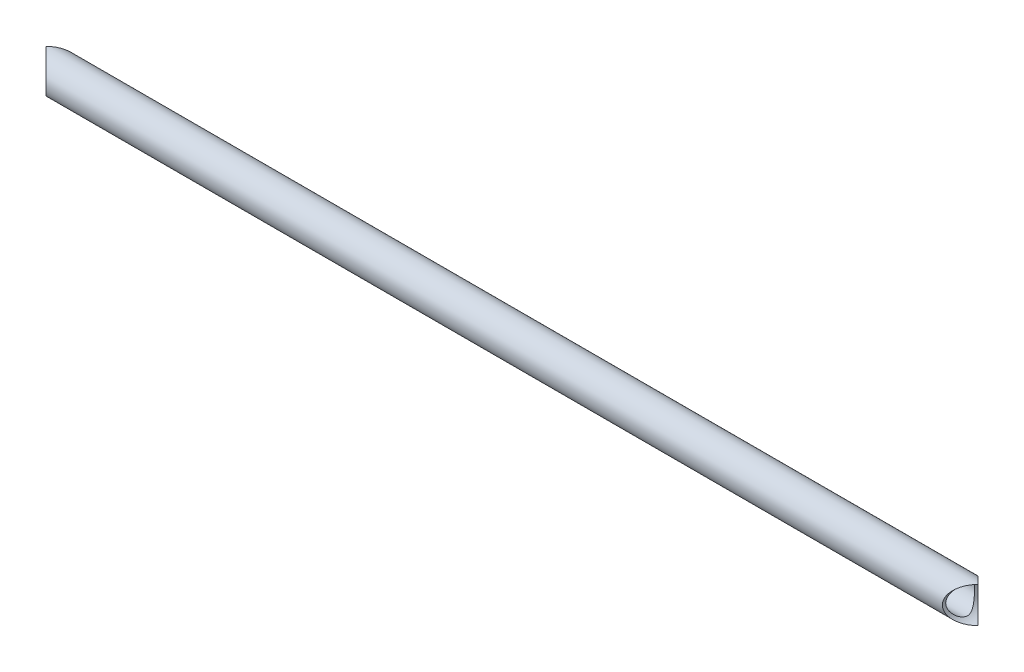
from build123d import *

# Parameters (mm, degrees)
SKETCH1_R                          = 7.9375
SKETCH1_R_2                        = 6.4375
PIPE_CONFIGURED_21_3_X_2_3_3_DEPTH = 415.043480752
CORTE_EXTRUS_O1_DEPTH              = 562.915780451
CORTE_EXTRUS_O1_DEPTH_BACK         = 562.915780451
ESBO_O10_R                         = 7.9375
CORTE_EXTRUS_O2_DEPTH              = 562.915780609
CORTE_EXTRUS_O2_DEPTH_BACK         = 562.915780609
ESBO_O11_R                         = 7.9375


with BuildPart() as part:
    # Sketch1 → Pipe - configured 21.3 X 2.3(3) (new body)
    with BuildSketch(Plane(origin=(58.531578249, 250, -150), x_dir=(0, 0, -1), z_dir=(1, 0, 0))):
        Circle(SKETCH1_R)
        Circle(SKETCH1_R_2, mode=Mode.SUBTRACT)
    extrude(amount=PIPE_CONFIGURED_21_3_X_2_3_3_DEPTH)

    # Esboço10 → Corte-extrusão1 (cut, two sides: drawn at the far end of the back side and taken through both)
    with BuildSketch(Plane.XY.offset(-CORTE_EXTRUS_O1_DEPTH_BACK)):
        with Locations((58.531578249, 250)):
            Circle(ESBO_O10_R)
    extrude(amount=CORTE_EXTRUS_O1_DEPTH + CORTE_EXTRUS_O1_DEPTH_BACK, mode=Mode.SUBTRACT)

    # Esboço11 → Corte-extrusão2 (cut, two sides: drawn at the far end of the back side and taken through both)
    with BuildSketch(Plane.XY.offset(-CORTE_EXTRUS_O2_DEPTH_BACK)):
        with Locations((473.575059, 250)):
            Circle(ESBO_O11_R)
    extrude(amount=CORTE_EXTRUS_O2_DEPTH + CORTE_EXTRUS_O2_DEPTH_BACK, mode=Mode.SUBTRACT)


solid = part.part
